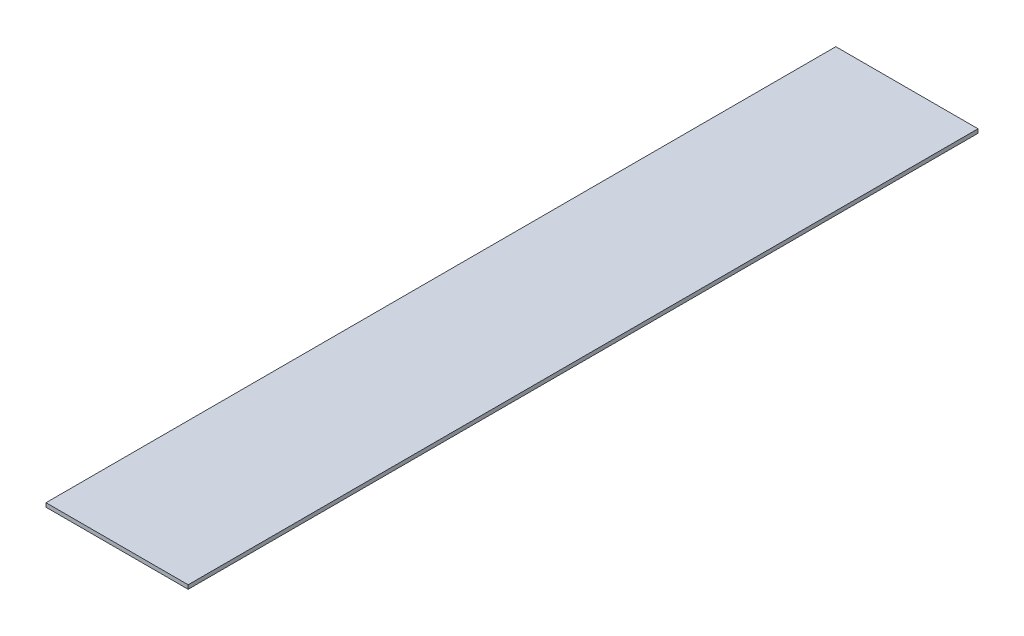
from build123d import *

# Parameters (mm, degrees)
SKETCH1_W           = 108
SKETCH1_H           = 600
BOSS_EXTRUDE1_DEPTH = 3


with BuildPart() as part:
    # Sketch1 → Boss-Extrude1 (new body)
    with BuildSketch(Plane(origin=(0, 0, 0), x_dir=(1, 0, 0), z_dir=(0, 1, 0))):
        Rectangle(SKETCH1_W, SKETCH1_H)
    extrude(amount=BOSS_EXTRUDE1_DEPTH)


solid = part.part
